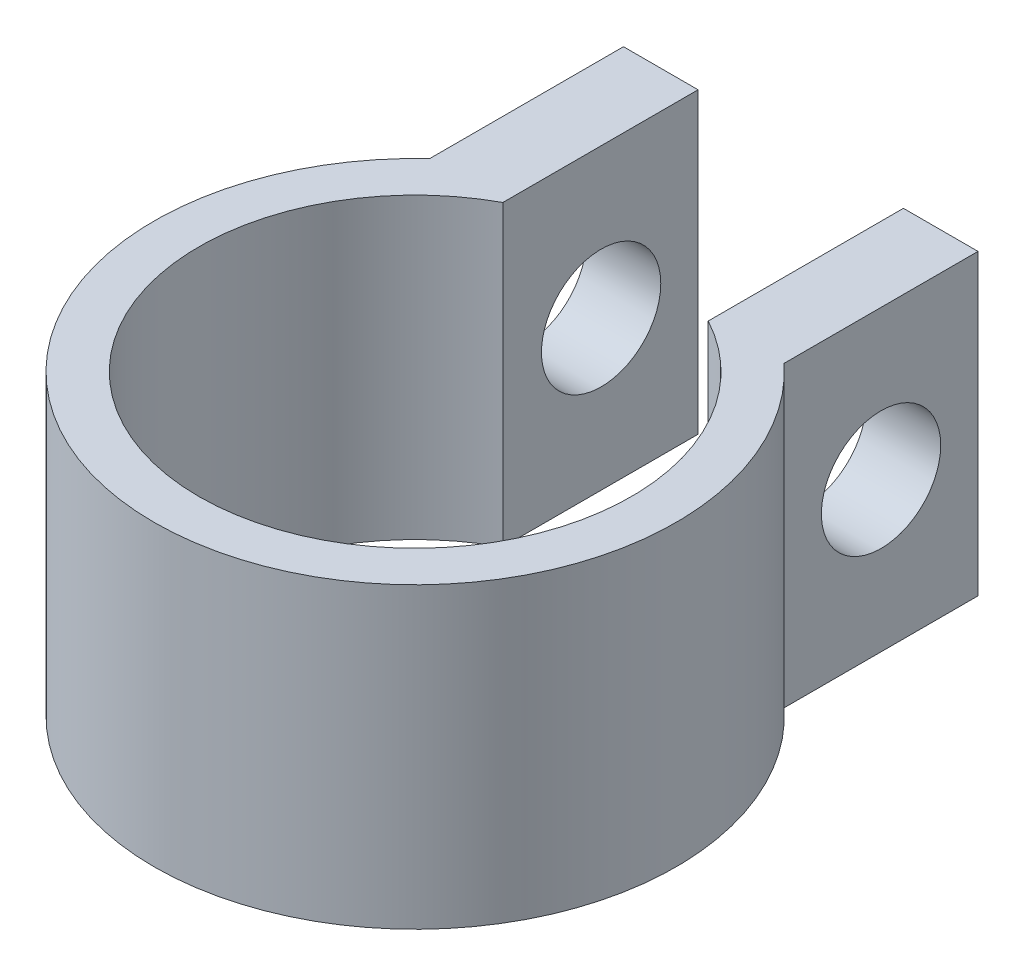
from build123d import *

# Parameters (mm, degrees)
BOSS_EXTRUDE1_DEPTH = 10
SKETCH2_R           = 2
CUT_EXTRUDE1_DEPTH  = 22.973952412


with BuildPart() as part:
    # Sketch1 → Boss-Extrude1 (new body)
    with BuildSketch(Plane(origin=(0, 0, 0), x_dir=(1, 0, 0), z_dir=(0, 1, 0))):
        with BuildLine():
            Line((-5.941155294, 12.923797457), (-5.941155294, 6.423797457))
            ThreePointArc((-5.941155294, 6.423797457), (0, -8.75), (5.941155294, 6.423797457))
            Line((5.941155294, 6.423797457), (5.941155294, 12.923797457))
            Line((5.941155294, 12.923797457), (3.441155294, 12.923797457))
            Line((3.441155294, 12.923797457), (3.441155294, 8.044933203))
            Line((3.441155294, 8.044933203), (3.441155294, 6.381296909))
            ThreePointArc((3.441155294, 6.381296909), (6.22538657, 3.715785524), (7.25, 0))
            ThreePointArc((7.25, 0), (-3.715785524, -6.22538657), (-3.441155294, 6.381296909))
            Line((-3.441155294, 6.381296909), (-3.441155294, 8.044933203))
            Line((-3.441155294, 8.044933203), (-3.441155294, 12.923797457))
            Line((-3.441155294, 12.923797457), (-5.941155294, 12.923797457))
        make_face()
    extrude(amount=BOSS_EXTRUDE1_DEPTH)

    # Sketch2 → Cut-Extrude1 (cut, through all)
    with BuildSketch(Plane(origin=(5.941155294, 0, 0), x_dir=(0, 0, -1), z_dir=(1, 0, 0))):
        with Locations((9.673797457, 5)):
            Circle(SKETCH2_R)
    extrude(amount=-CUT_EXTRUDE1_DEPTH, mode=Mode.SUBTRACT)


solid = part.part
